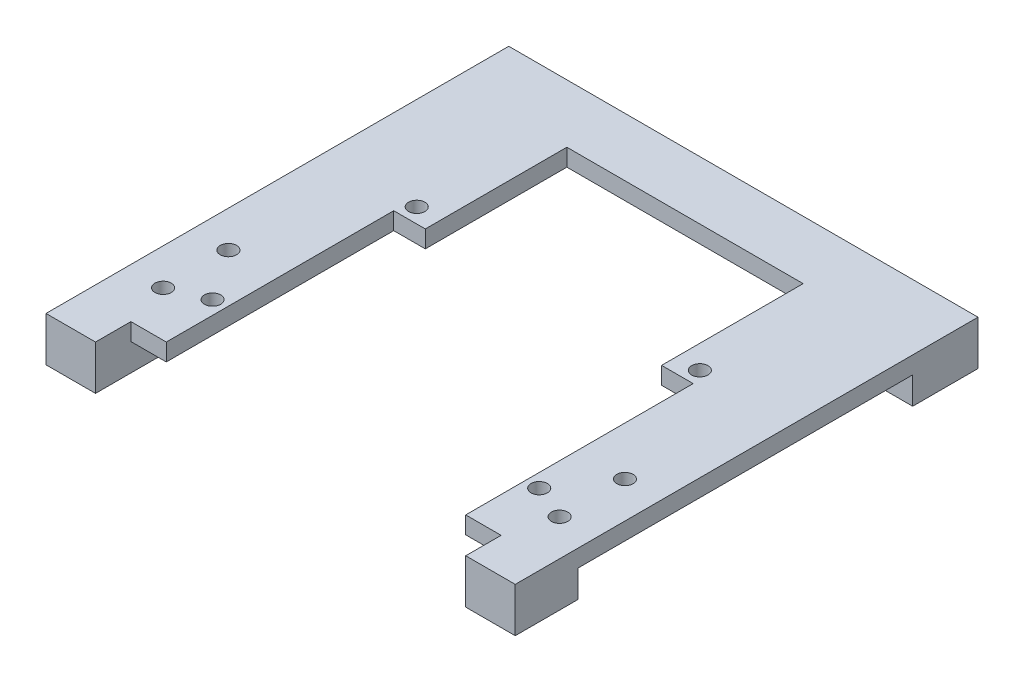
from build123d import *

# Parameters (mm, degrees)
BOSS_EXTRUDE4_DEPTH  = 3.175
M3_CLEARANCE_HOLE3_D = 3
M3_CLEARANCE_HOLE1_D = 3.1
M3_CLEARANCE_HOLE4_D = 2.95
M3_CLEARANCE_HOLE2_D = 3.1
CUT_EXTRUDE1_DEPTH   = 121.250075364
BOSS_EXTRUDE6_DEPTH  = 3.175
CUT_EXTRUDE3_DEPTH   = 121.250075364
SKETCH25_R           = 1.5
CUT_EXTRUDE4_DEPTH   = 121.250075364
SKETCH26_W           = 55
SKETCH26_H           = 60
CUT_EXTRUDE5_DEPTH   = 10
SKETCH27_OUTSIDE_W   = 217.324
SKETCH27_OUTSIDE_H   = 197.151
SKETCH27_OUTSIDE_W_2 = 86.188981544
SKETCH27_OUTSIDE_H_2 = 85
CUT_EXTRUDE6_DEPTH   = 10
SKETCH32_W           = 68
SKETCH32_H           = 11.5
CUT_EXTRUDE9_DEPTH   = 78.908304199
SKETCH33_W           = 9.094490772
SKETCH33_H           = 11.5
SKETCH33_W_2         = 8
SKETCH33_H_2         = 12
BOSS_EXTRUDE7_DEPTH  = 5
SKETCH34_W           = 6.5
SKETCH34_H           = 3.175
BOSS_EXTRUDE8_DEPTH  = 5
SKETCH35_R           = 1.5
CUT_EXTRUDE10_DEPTH  = 79.271667052
SKETCH38_W           = 18
SKETCH38_H           = 3.175
BOSS_EXTRUDE10_DEPTH = 5.8
SKETCH39_W           = 18
SKETCH39_H           = 3.175
BOSS_EXTRUDE11_DEPTH = 5.8
SKETCH37_R           = 1.5
CUT_EXTRUDE14_DEPTH  = 79.271667052
SKETCH40_W           = 43.4
SKETCH40_H           = 8
CUT_EXTRUDE15_DEPTH  = 79.271667052


with BuildPart() as part:
    # Sketch1 → Boss-Extrude4 (new body)
    with BuildSketch(Plane(origin=(0, 0, 0), x_dir=(1, 0, 0), z_dir=(0, 1, 0))):
        with BuildLine():
            Line((-62.799553621, 32.496136604), (-73.969425011, 32.691107434))
            Line((-73.969425011, 32.691107434), (-77.053684287, 35.88495141))
            ThreePointArc((-77.053684287, 35.88495141), (-84.36642289, 10.358894189), (-83.446216027, -16.178041625))
            Line((-83.446216027, -16.178041625), (-79.680911643, -13.825218315))
            Line((-79.680911643, -13.825218315), (-69.484649137, -16.179210996))
            Line((-69.484649137, -16.179210996), (-43.094490772, -58.412292655))
            Line((-43.094490772, -58.412292655), (-43.094490772, -64.826600275))
            Line((-43.094490772, -64.826600275), (-34, -64.826600275))
            Line((-34, -64.826600275), (-34, -58.55))
            Line((-34, -58.55), (34, -58.55))
            Line((34, -58.55), (34, -64.826600275))
            Line((34, -64.826600275), (43.094490772, -64.826600275))
            Line((43.094490772, -64.826600275), (43.094490772, -58.412292655))
            Line((43.094490772, -58.412292655), (69.484649137, -16.179210996))
            Line((69.484649137, -16.179210996), (79.680911643, -13.825218315))
            Line((79.680911643, -13.825218315), (83.446216027, -16.178041625))
            ThreePointArc((83.446216027, -16.178041625), (84.36642289, 10.358894189), (77.053684287, 35.88495141))
            Line((77.053684287, 35.88495141), (73.969425011, 32.691107434))
            Line((73.969425011, 32.691107434), (62.799553621, 32.496136604))
            Line((62.799553621, 32.496136604), (30.284668021, 63.895396642))
            Line((30.284668021, 63.895396642), (30.089697191, 75.065268032))
            Line((30.089697191, 75.065268032), (33.173956467, 78.259112008))
            ThreePointArc((33.173956467, 78.259112008), (0, 85), (-33.173956467, 78.259112008))
            Line((-33.173956467, 78.259112008), (-30.089697191, 75.065268032))
            Line((-30.089697191, 75.065268032), (-30.284668021, 63.895396642))
            Line((-30.284668021, 63.895396642), (-62.799553621, 32.496136604))
        make_face()
    extrude(amount=BOSS_EXTRUDE4_DEPTH)

    # M3 Clearance Hole3 (through all)
    with Locations(Plane(origin=(0, 0, 0), x_dir=(-1, 0, 0), z_dir=(0, -1, 0))):
        with Locations((36.415, -50), (36.415, -38), (-36.415, -50), (-36.415, -38)):
            Hole(M3_CLEARANCE_HOLE3_D / 2)

    # M3 Clearance Hole1 (through all)
    with Locations(Plane(origin=(0, 3.175, 0), x_dir=(1, 0, 0), z_dir=(0, 1, 0))):
        with Locations((-78.542321426, -8.49139241), (78.542321426, -8.49139241), (74.155025063, 27.240269049), (-74.155025063, 27.240269049)):
            Hole(M3_CLEARANCE_HOLE1_D / 2)

    # M3 Clearance Hole4 (through all)
    with Locations(Plane(origin=(0, 0, 0), x_dir=(-1, 0, 0), z_dir=(0, -1, 0))):
        with Locations((-67.099301622, -15.278865202), (-50.141885166, -42.416404279), (-61.062544382, 30.698137949), (-38.043670771, 52.927205804), (50.141885166, -42.416404279), (67.099301622, -15.278865202), (38.043670771, 52.927205804), (61.062544382, 30.698137949)):
            Hole(M3_CLEARANCE_HOLE4_D / 2)

    # M3 Clearance Hole2 (through all)
    with Locations(Plane(origin=(0, 3.175, 0), x_dir=(1, 0, 0), z_dir=(0, 1, 0))):
        with Locations((27, 76.497766718), (-27, 76.497766718)):
            Hole(M3_CLEARANCE_HOLE2_D / 2)

    # Sketch20 → Cut-Extrude1 (cut, through all)
    with BuildSketch(Plane(origin=(0, 3.175, 0), x_dir=(1, 0, 0), z_dir=(0, 1, 0))):
        with BuildLine():
            Line((-14.64850035, 45.5), (-14.64850035, 40.5))
            ThreePointArc((-14.64850035, 40.5), (-16.14850035, 39), (-17.64850035, 40.5))
            Line((-17.64850035, 40.5), (-17.64850035, 45.5))
            ThreePointArc((-17.64850035, 45.5), (-16.14850035, 47), (-14.64850035, 45.5))
        make_face()
        with BuildLine():
            Line((14.64850035, 45.5), (14.64850035, 40.5))
            ThreePointArc((14.64850035, 40.5), (16.14850035, 39), (17.64850035, 40.5))
            Line((17.64850035, 40.5), (17.64850035, 45.5))
            ThreePointArc((17.64850035, 45.5), (16.14850035, 47), (14.64850035, 45.5))
        make_face()
    extrude(amount=-CUT_EXTRUDE1_DEPTH, mode=Mode.SUBTRACT)

    # Sketch22 → Boss-Extrude6 (add)
    with BuildSketch(Plane(origin=(0, 3.175, 0), x_dir=(1, 0, 0), z_dir=(0, 1, 0))):
        Polygon((-30.284668021, 63.895396642), (-30.245177733, 66.157793715), (-65.061950694, 32.535626892), (-62.799553621, 32.496136604), align=None)
        Polygon((-69.484649137, -16.179210996), (-71.689396914, -15.670204865), (-43.094490772, -61.431620518), (-43.094490772, -58.412292655), align=None)
        Polygon((43.094490772, -61.431620518), (71.689396914, -15.670204865), (69.484649137, -16.179210996), (43.094490772, -58.412292655), align=None)
        Polygon((65.061950694, 32.535626892), (30.245177733, 66.157793715), (30.284668021, 63.895396642), (62.799553621, 32.496136604), align=None)
    extrude(amount=-BOSS_EXTRUDE6_DEPTH)

    # Sketch24 → Cut-Extrude3 (cut, through all)
    with BuildSketch(Plane(origin=(0, 3.175, 0), x_dir=(1, 0, 0), z_dir=(0, 1, 0))):
        Polygon((-27, -52.75), (-27, -22.75), (-21.2, -22.75), (-21.2, 1.45), (0, 1.45), (21.2, 1.45), (21.2, -22.75), (27, -22.75), (27, -52.75), (21.2, -52.75), (21.2, -58.55), (-21.2, -58.55), (-21.2, -52.75), align=None)
    extrude(amount=-CUT_EXTRUDE3_DEPTH, mode=Mode.SUBTRACT)

    # Sketch25 → Cut-Extrude4 (cut, through all)
    with BuildSketch(Plane(origin=(0, 3.175, 0), x_dir=(1, 0, 0), z_dir=(0, 1, 0))):
        with Locations(Location((-24.1, -55.65, 0), (0, 0, 270))):
            Circle(SKETCH25_R)
        with Locations(Location((-24.1, -19.85, 0), (0, 0, 270))):
            Circle(SKETCH25_R)
        with Locations(Location((24.1, -19.85, 0), (0, 0, 270))):
            Circle(SKETCH25_R)
        with Locations(Location((24.1, -55.65, 0), (0, 0, 270))):
            Circle(SKETCH25_R)
    extrude(amount=-CUT_EXTRUDE4_DEPTH, mode=Mode.SUBTRACT)

    # Sketch26 → Cut-Extrude5 (cut)
    with BuildSketch(Plane(origin=(0, 3.175, 0), x_dir=(1, 0, 0), z_dir=(0, 1, 0))):
        with Locations((0, -28.55)):
            Rectangle(SKETCH26_W, SKETCH26_H)
    extrude(amount=-CUT_EXTRUDE5_DEPTH, mode=Mode.SUBTRACT)

    # Sketch27 outside → Cut-Extrude6 (cut)
    with BuildSketch(Plane(origin=(0, 3.175, 0), x_dir=(1, 0, 0), z_dir=(0, 1, 0))):
        with Locations((0, 10.0865)):
            Rectangle(SKETCH27_OUTSIDE_W, SKETCH27_OUTSIDE_H)
        with Locations((0, -22.326600275)):
            Rectangle(SKETCH27_OUTSIDE_W_2, SKETCH27_OUTSIDE_H_2, mode=Mode.SUBTRACT)
    extrude(amount=-CUT_EXTRUDE6_DEPTH, mode=Mode.SUBTRACT)

    # Sketch32 → Cut-Extrude9 (cut, through all)
    with BuildSketch(Plane(origin=(0, 3.175, 0), x_dir=(1, 0, 0), z_dir=(0, 1, 0))):
        with Locations((0, -59.076600275)):
            Rectangle(SKETCH32_W, SKETCH32_H)
    extrude(amount=-CUT_EXTRUDE9_DEPTH, mode=Mode.SUBTRACT)

    # Sketch33 → Boss-Extrude7 (add)
    with BuildSketch(Plane.XZ):
        with Locations((-38.547245386, 59.076600275)):
            Rectangle(SKETCH33_W, SKETCH33_H)
        with Locations((38.547245386, 59.076600275)):
            Rectangle(SKETCH33_W, SKETCH33_H)
        with Locations((-39.094490772, -14.173399725)):
            Rectangle(SKETCH33_W_2, SKETCH33_H_2)
        with Locations((39.094490772, -14.173399725)):
            Rectangle(SKETCH33_W_2, SKETCH33_H_2)
    extrude(amount=BOSS_EXTRUDE7_DEPTH)

    # Sketch34 → Boss-Extrude8 (add)
    with BuildSketch(Plane.XY.offset(53.326600275)):
        with Locations((-30.75, 1.5875)):
            Rectangle(SKETCH34_W, SKETCH34_H)
        with Locations((30.75, 1.5875)):
            Rectangle(SKETCH34_W, SKETCH34_H)
    extrude(amount=BOSS_EXTRUDE8_DEPTH)

    # Sketch35 → Cut-Extrude10 (cut, through all)
    with BuildSketch(Plane(origin=(0, 3.175, 0), x_dir=(1, 0, 0), z_dir=(0, 1, 0))):
        with Locations(Location((-30, -47.326600275, 0), (0, 0, 270))):
            Circle(SKETCH35_R)
        with Locations(Location((30, -47.326600275, 0), (0, 0, 270))):
            Circle(SKETCH35_R)
    extrude(amount=-CUT_EXTRUDE10_DEPTH, mode=Mode.SUBTRACT)

    # Sketch38 → Boss-Extrude10 (add)
    with BuildSketch(Plane(origin=(-27.5, 0, 0), x_dir=(0, 0, -1), z_dir=(1, 0, 0))):
        with Locations((-7.55, 1.5875)):
            Rectangle(SKETCH38_W, SKETCH38_H)
    extrude(amount=BOSS_EXTRUDE10_DEPTH)

    # Sketch39 → Boss-Extrude11 (add)
    with BuildSketch(Plane.ZY.offset(-27.5)):
        with Locations((7.55, 1.5875)):
            Rectangle(SKETCH39_W, SKETCH39_H)
    extrude(amount=BOSS_EXTRUDE11_DEPTH)

    # Sketch37 → Cut-Extrude14 (cut, through all)
    with BuildSketch(Plane(origin=(0, 3.175, 0), x_dir=(1, 0, 0), z_dir=(0, 1, 0))):
        with Locations(Location((-26, -13.826600275, 0), (0, 0, 270))):
            Circle(SKETCH37_R)
        with Locations(Location((26, -13.826600275, 0), (0, 0, 270))):
            Circle(SKETCH37_R)
    extrude(amount=-CUT_EXTRUDE14_DEPTH, mode=Mode.SUBTRACT)

    # Sketch40 → Cut-Extrude15 (cut, through all)
    with BuildSketch(Plane(origin=(0, 3.175, 0), x_dir=(1, 0, 0), z_dir=(0, 1, 0))):
        with Locations((0, 5.45)):
            Rectangle(SKETCH40_W, SKETCH40_H)
    extrude(amount=-CUT_EXTRUDE15_DEPTH, mode=Mode.SUBTRACT)


solid = part.part
